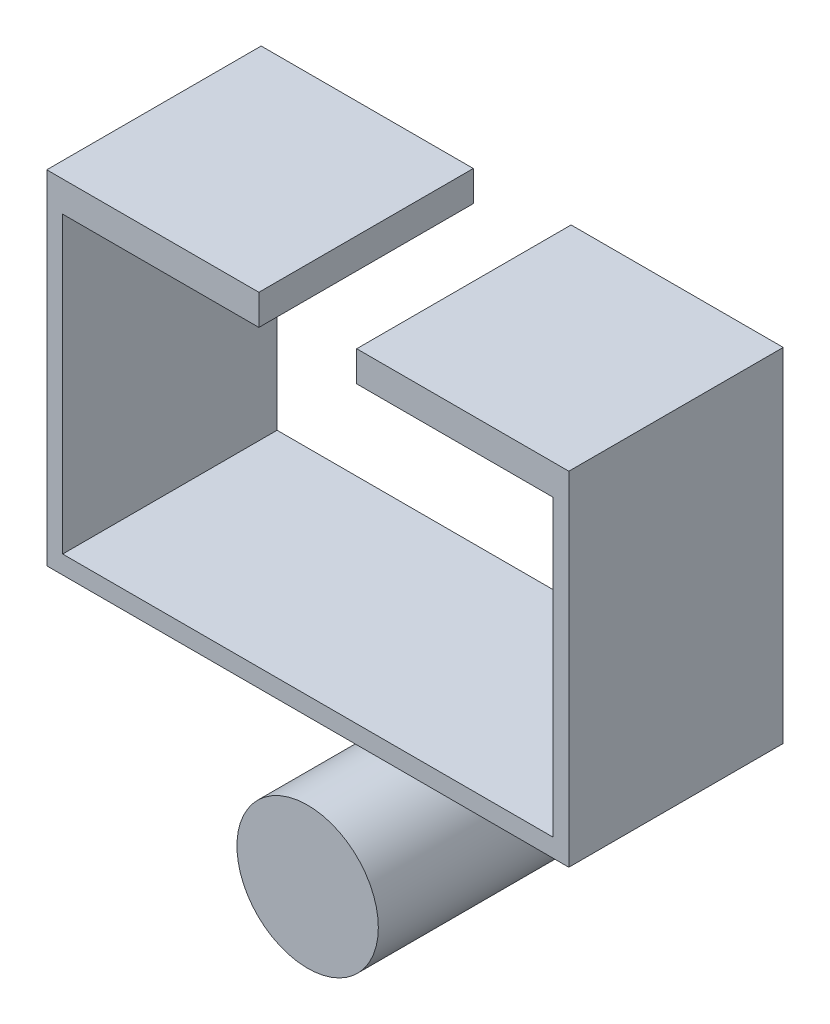
from build123d import *

# Parameters (mm, degrees)
BOSS_EXTRUDE1_DEPTH = 27.731531852
BOSS_EXTRUDE2_DEPTH = 2.351851852
SKETCH4_R           = 9.144
BOSS_EXTRUDE3_DEPTH = 25.4


with BuildPart() as part:
    # Sketch1 → Boss-Extrude1 (new body)
    with BuildSketch(Plane.XY):
        Polygon((-33.76168, 0), (33.76168, 0), (33.76168, 44.363451852), (6.3246, 44.363451852), (6.3246, 40.426451852), (31.70428, 40.426451852), (31.70428, 2.351851852), (-31.70428, 2.351851852), (-31.70428, 40.426451852), (-6.3246, 40.426451852), (-6.3246, 44.363451852), (-33.76168, 44.363451852), align=None)
    extrude(amount=BOSS_EXTRUDE1_DEPTH)

    # Sketch2 → Boss-Extrude2 (add)
    with BuildSketch(Plane.XY):
        with BuildLine():
            Line((-9.144, 0), (9.144, 0))
            Line((9.144, 0), (9.144, -19.05))
            ThreePointArc((9.144, -19.05), (0, -28.194), (-9.144, -19.05))
            Line((-9.144, -19.05), (-9.144, 0))
        make_face()
    extrude(amount=BOSS_EXTRUDE2_DEPTH)

    # Sketch4 → Boss-Extrude3 (add)
    with BuildSketch(Plane.XY.offset(2.351851852)):
        with Locations((0, -19.05)):
            Circle(SKETCH4_R)
    extrude(amount=BOSS_EXTRUDE3_DEPTH)


solid = part.part
